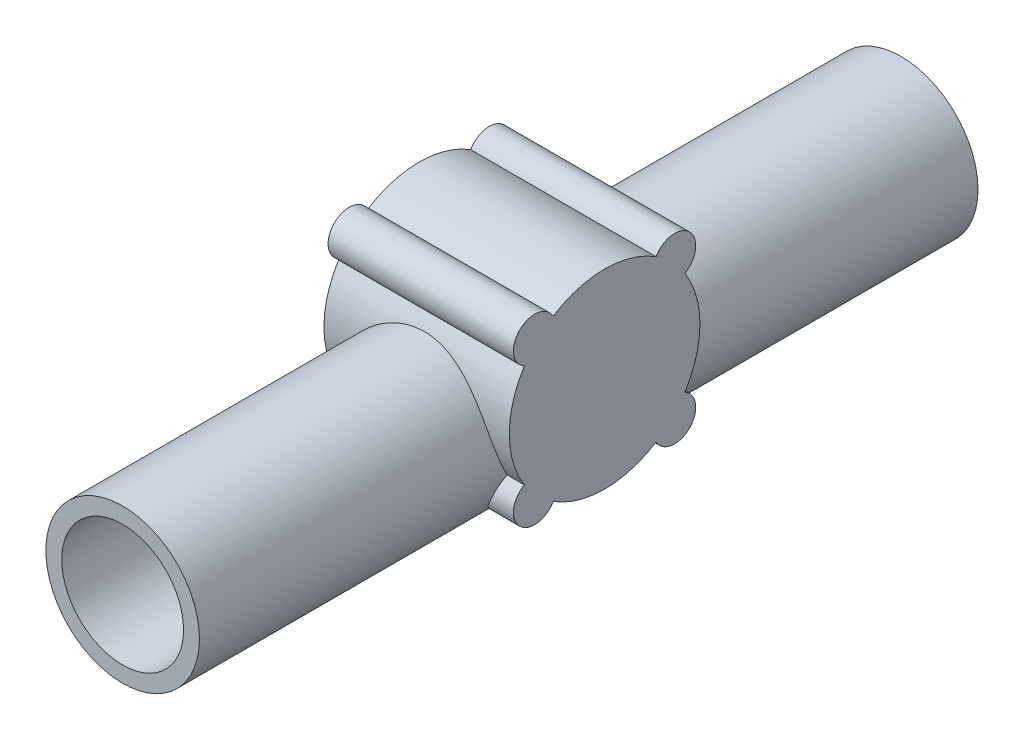
from build123d import *

# Parameters (mm, degrees)
SKETCH1_R           = 14.5
BOSS_EXTRUDE1_DEPTH = 147
SKETCH3_R           = 18
BOSS_EXTRUDE2_DEPTH = 17.5
BOSS_EXTRUDE3_START = 17.5
SKETCH4_R           = 18
BOSS_EXTRUDE3_DEPTH = 17.5
SKETCH5_R           = 4
BOSS_EXTRUDE4_DEPTH = 35
SKETCH2_R           = 11.5
CUT_EXTRUDE1_DEPTH  = 147


with BuildPart() as part:
    # Sketch1 → Boss-Extrude1 (new body)
    with BuildSketch(Plane.XY):
        Circle(SKETCH1_R)
    extrude(amount=BOSS_EXTRUDE1_DEPTH)

    # Sketch3 → Boss-Extrude2 (add)
    with BuildSketch(Plane(origin=(0, 0, 0), x_dir=(0, 0, -1), z_dir=(1, 0, 0))):
        with Locations(Location((-73.5, 7.25, 0), (0, 0, 156.248053974))):
            Circle(SKETCH3_R)
    extrude(amount=BOSS_EXTRUDE2_DEPTH)

    # Sketch4 → Boss-Extrude3 (add)
    with BuildSketch(Plane.ZY.offset(BOSS_EXTRUDE3_START)):
        with Locations((73.5, 7.25)):
            Circle(SKETCH4_R)
    extrude(amount=-BOSS_EXTRUDE3_DEPTH)

    # Sketch5 → Boss-Extrude4 (add)
    with BuildSketch(Plane(origin=(17.5, 0, 0), x_dir=(0, 0, -1), z_dir=(1, 0, 0))):
        with Locations((-60.288298956, 20.461701044)):
            Circle(SKETCH5_R)
        with Locations((-86.711701044, 20.461701044)):
            Circle(SKETCH5_R)
        with Locations((-60.288298956, -5.961701044)):
            Circle(SKETCH5_R)
        with Locations((-86.711701044, -5.961701044)):
            Circle(SKETCH5_R)
    extrude(amount=-BOSS_EXTRUDE4_DEPTH)

    # Sketch2 → Cut-Extrude1 (cut)
    with BuildSketch(Plane.XY.offset(147)):
        Circle(SKETCH2_R)
    extrude(amount=-CUT_EXTRUDE1_DEPTH, mode=Mode.SUBTRACT)


solid = part.part
